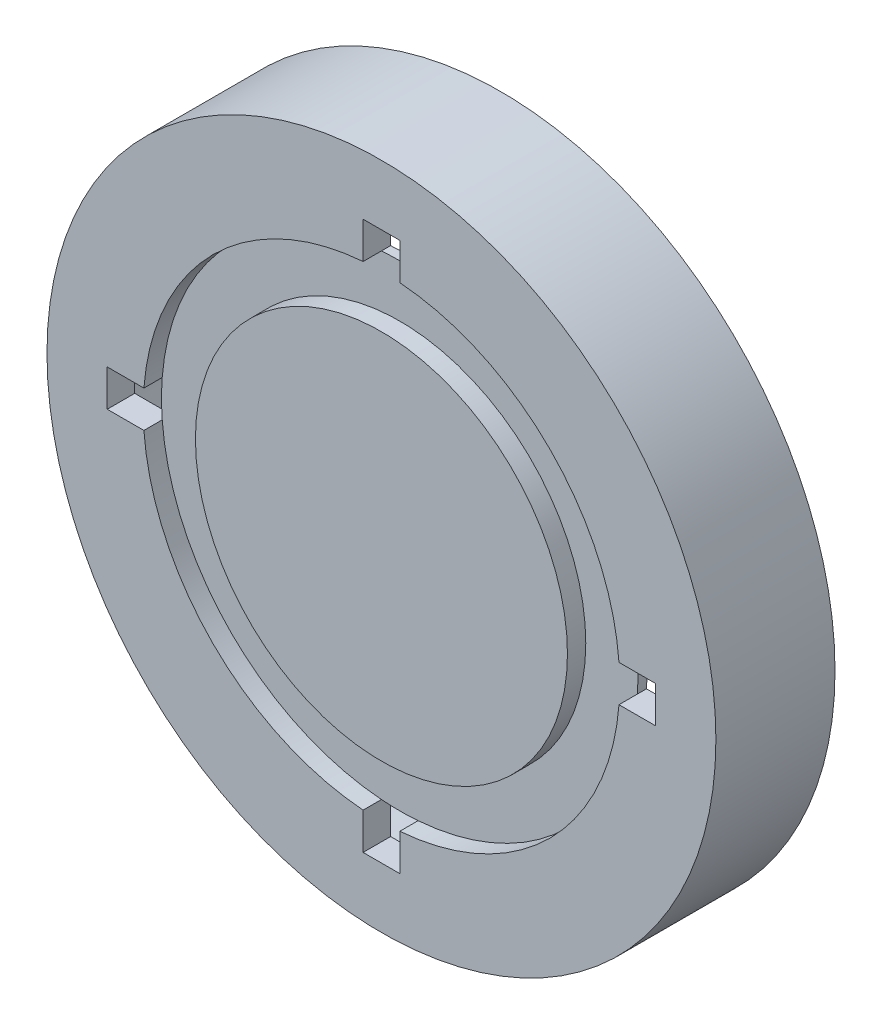
from build123d import *

# Parameters (mm, degrees)
SKETCH1_R           = 46.355
BOSS_EXTRUDE1_DEPTH = 3.81
SKETCH2_R           = 33.02
SKETCH2_R_2         = 25.781
CUT_EXTRUDE1_DEPTH  = 2.54
CUT_EXTRUDE2_DEPTH  = 66.666491836
BOSS_EXTRUDE2_START = 12.7
SKETCH4_R           = 46.355
SKETCH4_R_2         = 44.45
BOSS_EXTRUDE2_DEPTH = 12.7


with BuildPart() as part:
    # Sketch1 → Boss-Extrude1 (new body)
    with BuildSketch(Plane.XY):
        with Locations(Location((0, 0, 0), (0, 0, 180))):
            Circle(SKETCH1_R)
    extrude(amount=BOSS_EXTRUDE1_DEPTH)

    # Sketch2 → Cut-Extrude1 (cut)
    with BuildSketch(Plane.XY.offset(3.81)):
        Circle(SKETCH2_R)
        Circle(SKETCH2_R_2, mode=Mode.SUBTRACT)
    extrude(amount=-CUT_EXTRUDE1_DEPTH, mode=Mode.SUBTRACT)

    # Sketch3 → Cut-Extrude2 (cut, through all)
    with BuildSketch(Plane.XY.offset(3.81)):
        with BuildLine():
            ThreePointArc((0, 33.02), (1.270941789, 32.995531621), (2.54, 32.922162748))
            Line((2.54, 32.922162748), (2.54, 38.002162748))
            Line((2.54, 38.002162748), (0, 38.002162748))
            Line((0, 38.002162748), (0, 33.02))
        make_face()
        with BuildLine():
            ThreePointArc((-2.54, 32.922162748), (-1.270941789, 32.995531621), (0, 33.02))
            Line((0, 33.02), (0, 38.002162748))
            Line((0, 38.002162748), (-2.54, 38.002162748))
            Line((-2.54, 38.002162748), (-2.54, 32.922162748))
        make_face()
        with BuildLine():
            Line((-38.002162748, -2.54), (-32.922162748, -2.54))
            ThreePointArc((-32.922162748, -2.54), (-33.02, 0), (-32.922162748, 2.54))
            Line((-32.922162748, 2.54), (-38.002162748, 2.54))
            Line((-38.002162748, 2.54), (-38.002162748, -2.54))
        make_face()
        with BuildLine():
            Line((2.54, -38.002162748), (2.54, -32.922162748))
            ThreePointArc((2.54, -32.922162748), (0, -33.02), (-2.54, -32.922162748))
            Line((-2.54, -32.922162748), (-2.54, -38.002162748))
            Line((-2.54, -38.002162748), (2.54, -38.002162748))
        make_face()
        with BuildLine():
            ThreePointArc((33.02, 0), (32.995531621, -1.270941789), (32.922162748, -2.54))
            Line((32.922162748, -2.54), (38.002162748, -2.54))
            Line((38.002162748, -2.54), (38.002162748, 2.54))
            Line((38.002162748, 2.54), (32.922162748, 2.54))
            ThreePointArc((32.922162748, 2.54), (32.995531621, 1.270941789), (33.02, 0))
        make_face()
    extrude(amount=-CUT_EXTRUDE2_DEPTH, mode=Mode.SUBTRACT)

    # Sketch4 → Boss-Extrude2 (add)
    with BuildSketch(Plane(origin=(0, 0, 0), x_dir=(-1, 0, 0), z_dir=(0, 0, -1)).offset(BOSS_EXTRUDE2_START)):
        Circle(SKETCH4_R)
        with Locations(Location((0, 0, 0), (0, 0, 180))):
            Circle(SKETCH4_R_2, mode=Mode.SUBTRACT)
    extrude(amount=-BOSS_EXTRUDE2_DEPTH)


solid = part.part
